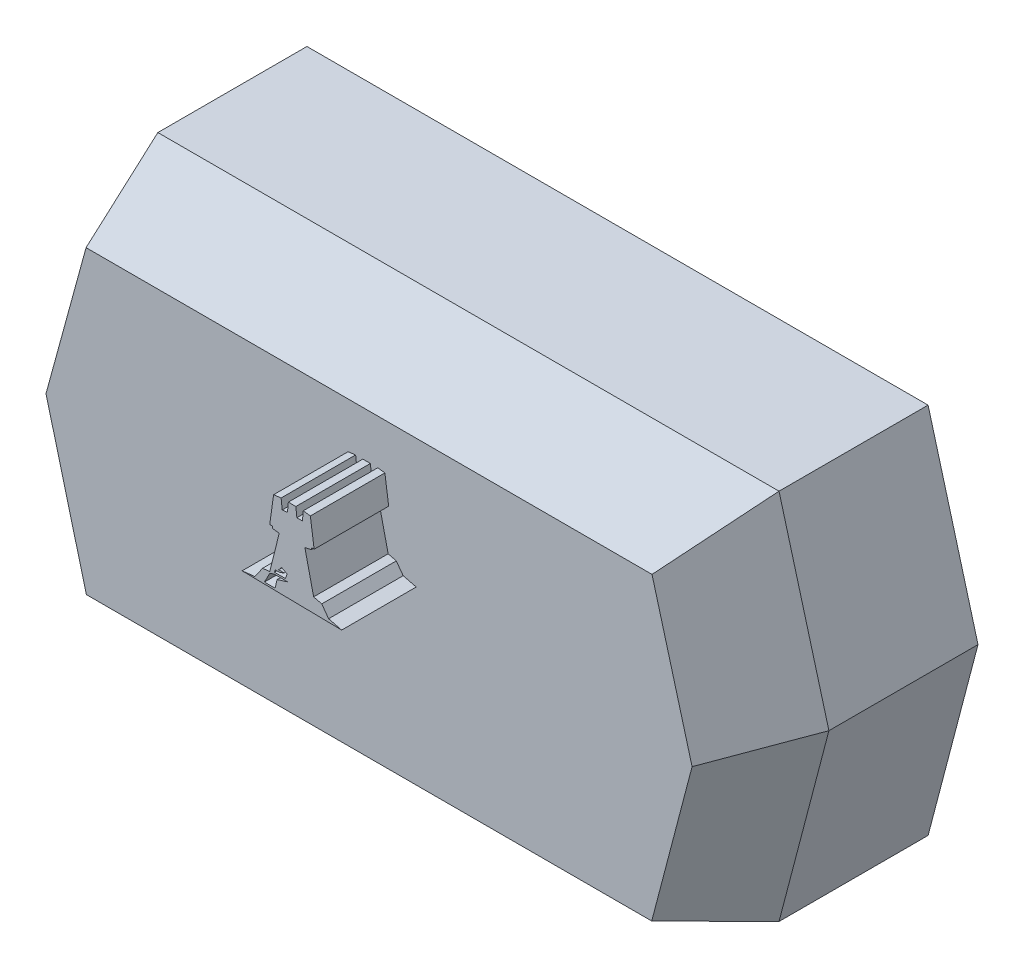
from build123d import *
from OCP.BRepFilletAPI import BRepFilletAPI_MakeChamfer

# Parameters (mm, degrees)
EXTRUDE_1_DEPTH = 10
CHAMFER_4_SIZE  = 4
CHAMFER_4_SIZE2 = 1.455880937
EXTRUDE_2_DEPTH = 3


with BuildPart() as part:
    # 草图1 → 凸台-拉伸1 (new body)
    with BuildSketch(Plane.XY):
        Polygon((-12.5, 7.5), (-14.508805155, 0.156246539), (-12.5, -7.5), (12.5, -7.5), (14.508805155, 0.156246539), (12.5, 7.5), align=None)
    extrude(amount=EXTRUDE_1_DEPTH)

    # 倒角4: one chamfer whose edges measure the first distance from different faces: ONE call of the kernel's chamfer builder (chamfer() names one face for all edges)
    chamfer_4_edges_1 = [part.edges().sort_by_distance(p)[0] for p in [
        (-13.504402578, 3.82812327, 10),
    ]]
    chamfer_4_side_1 = [part.faces().sort_by_distance(p)[0] for p in [
        (-13.504402578, 3.82812327, 5),
    ]]
    chamfer_4_edges_2 = [part.edges().sort_by_distance(p)[0] for p in [
        (-13.504402578, -3.67187673, 10),
    ]]
    chamfer_4_side_2 = [part.faces().sort_by_distance(p)[0] for p in [
        (-13.504402578, -3.67187673, 5),
    ]]
    chamfer_4_edges_3 = [part.edges().sort_by_distance(p)[0] for p in [
        (0, -7.5, 10),
    ]]
    chamfer_4_side_3 = [part.faces().sort_by_distance(p)[0] for p in [
        (0, -7.5, 5),
    ]]
    chamfer_4_edges_4 = [part.edges().sort_by_distance(p)[0] for p in [
        (13.504402578, -3.67187673, 10),
    ]]
    chamfer_4_side_4 = [part.faces().sort_by_distance(p)[0] for p in [
        (13.504402578, -3.67187673, 5),
    ]]
    chamfer_4_edges_5 = [part.edges().sort_by_distance(p)[0] for p in [
        (13.504402578, 3.82812327, 10),
    ]]
    chamfer_4_side_5 = [part.faces().sort_by_distance(p)[0] for p in [
        (13.504402578, 3.82812327, 5),
    ]]
    chamfer_4_edges_6 = [part.edges().sort_by_distance(p)[0] for p in [
        (0, 7.5, 10),
    ]]
    chamfer_4_side_6 = [part.faces().sort_by_distance(p)[0] for p in [
        (0, 7.5, 5),
    ]]
    chamfer_4 = BRepFilletAPI_MakeChamfer(part.part.solid().wrapped)
    for e in chamfer_4_edges_1:
        chamfer_4.Add(CHAMFER_4_SIZE, CHAMFER_4_SIZE2, e.wrapped, chamfer_4_side_1[0].wrapped)  # the first distance lies on this face
    for e in chamfer_4_edges_2:
        chamfer_4.Add(CHAMFER_4_SIZE, CHAMFER_4_SIZE2, e.wrapped, chamfer_4_side_2[0].wrapped)  # the first distance lies on this face
    for e in chamfer_4_edges_3:
        chamfer_4.Add(CHAMFER_4_SIZE, CHAMFER_4_SIZE2, e.wrapped, chamfer_4_side_3[0].wrapped)  # the first distance lies on this face
    for e in chamfer_4_edges_4:
        chamfer_4.Add(CHAMFER_4_SIZE, CHAMFER_4_SIZE2, e.wrapped, chamfer_4_side_4[0].wrapped)  # the first distance lies on this face
    for e in chamfer_4_edges_5:
        chamfer_4.Add(CHAMFER_4_SIZE, CHAMFER_4_SIZE2, e.wrapped, chamfer_4_side_5[0].wrapped)  # the first distance lies on this face
    for e in chamfer_4_edges_6:
        chamfer_4.Add(CHAMFER_4_SIZE, CHAMFER_4_SIZE2, e.wrapped, chamfer_4_side_6[0].wrapped)  # the first distance lies on this face
    add(Compound.cast(chamfer_4.Shape()), mode=Mode.REPLACE)

    # 草图4 → 凸台-拉伸2 (add)
    with BuildSketch(Plane.XY.offset(10)):
        Polygon((-0.842329886, 4.204878172), (-0.997111855, 3.082708897), (-0.875425349, 3.0960765), (-0.88342019, 3.010417485), (-0.615021943, 2.973869638), (-0.997111855, 1.451293683), (-1.286540896, 1.419499093), (-1.593044591, 0.977341926), (-2.107271415, 0.920852672), (1.898363481, 0.85858655), (1.373153369, 0.990387846), (1.096764689, 1.369234669), (0.769770761, 1.451293683), (0.417287548, 2.992143562), (0.684395911, 3.053246992), (0.684395911, 3.120908441), (0.790079324, 3.120908441), (0.637139108, 4.204878172), (0.353273229, 4.243532249), (0.31846389, 3.870575043), (0.095475844, 3.870575043), (0.054505452, 4.243532249), (-0.248639641, 4.243532249), (-0.28344898, 3.870575043), (-0.496098331, 3.847214918), (-0.539634898, 4.243532249), align=None)
        Polygon((-1.210689891, 0.977341926), (-0.783853716, 0.977341926), (-0.697469796, 1.321570013), (-0.266044311, 1.451293683), (-0.806066899, 1.451293683), (-0.991003184, 1.395685902), align=None, mode=Mode.SUBTRACT)
        Polygon((-0.806066899, 1.521254444), (-0.364830167, 1.521254444), (-0.29903642, 1.713574629), (-0.43352874, 1.784201139), (-0.517866614, 1.828489836), (-0.635596744, 1.693330399), (-0.417971271, 1.693330399), (-0.585448533, 1.617414536), (-0.774567684, 1.617414536), align=None, mode=Mode.SUBTRACT)
    extrude(amount=EXTRUDE_2_DEPTH)


solid = part.part
